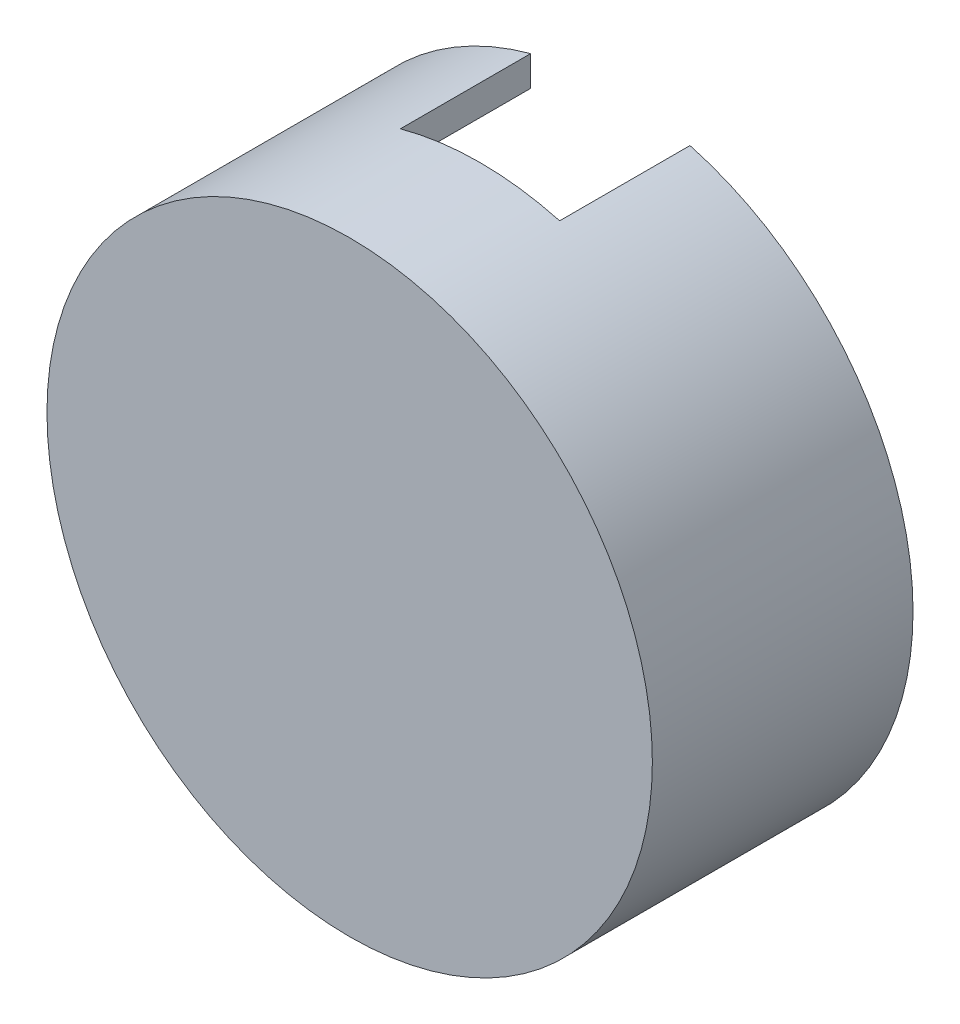
from build123d import *

# Parameters (mm, degrees)
SKIZZE2_W                       = 11
SKIZZE2_H                       = 9
SCHNITT_LINEAR_AUSTRAGEN2_DEPTH = 25
SKIZZE3_W                       = 2.03
SKIZZE3_H                       = 2.5
AUFSATZ_LINEAR_AUSTRAGEN1_DEPTH = 18.902
SKIZZE3_3_W                     = 2.03
SKIZZE3_3_H                     = 2.5
SCHNITT_LINEAR_AUSTRAGEN3_DEPTH = 16.402


with BuildPart() as part:
    # Skizze1 → Rotation2 (revolve)
    with BuildSketch(Plane(origin=(0, 0, 0), x_dir=(1, 0, 0), z_dir=(0, 1, 0))):
        Polygon((0.00340061, -8.034840547), (0.00340061, -10.034840547), (20.90540061, -10.034840547), (20.90540061, 7.965159453), (18.90540061, 7.965159453), (18.90540061, -2.034840547), (17.40540061, -2.034840547), (17.40540061, -4.034840547), (18.90540061, -4.034840547), (18.90540061, -8.034840547), align=None)
    revolve(axis=Axis((0.00340061, 0, 8.034840547), (0, 0, 1)))

    # Skizze2 → Schnitt-Linear austragen2 (cut)
    with BuildSketch(Plane(origin=(0, 0, 0), x_dir=(1, 0, 0), z_dir=(0, 1, 0))):
        with Locations((0.00340061, 3.465159453)):
            Rectangle(SKIZZE2_W, SKIZZE2_H)
    extrude(amount=SCHNITT_LINEAR_AUSTRAGEN2_DEPTH, mode=Mode.SUBTRACT)

    # Skizze3 → Aufsatz-Linear austragen1 (add)
    with BuildSketch(Plane(origin=(0, 0, 0), x_dir=(0, 0, -1), z_dir=(1, 0, 0))):
        with Locations((-1.015, 0)):
            Rectangle(SKIZZE3_W, SKIZZE3_H)
    extrude(amount=-AUFSATZ_LINEAR_AUSTRAGEN1_DEPTH)

    # Skizze3<3> → Schnitt-Linear austragen3 (cut)
    with BuildSketch(Plane(origin=(0, 0, 0), x_dir=(0, 0, -1), z_dir=(1, 0, 0))):
        with Locations((-1.015, 0)):
            Rectangle(SKIZZE3_3_W, SKIZZE3_3_H)
    extrude(amount=-SCHNITT_LINEAR_AUSTRAGEN3_DEPTH, mode=Mode.SUBTRACT)


solid = part.part
